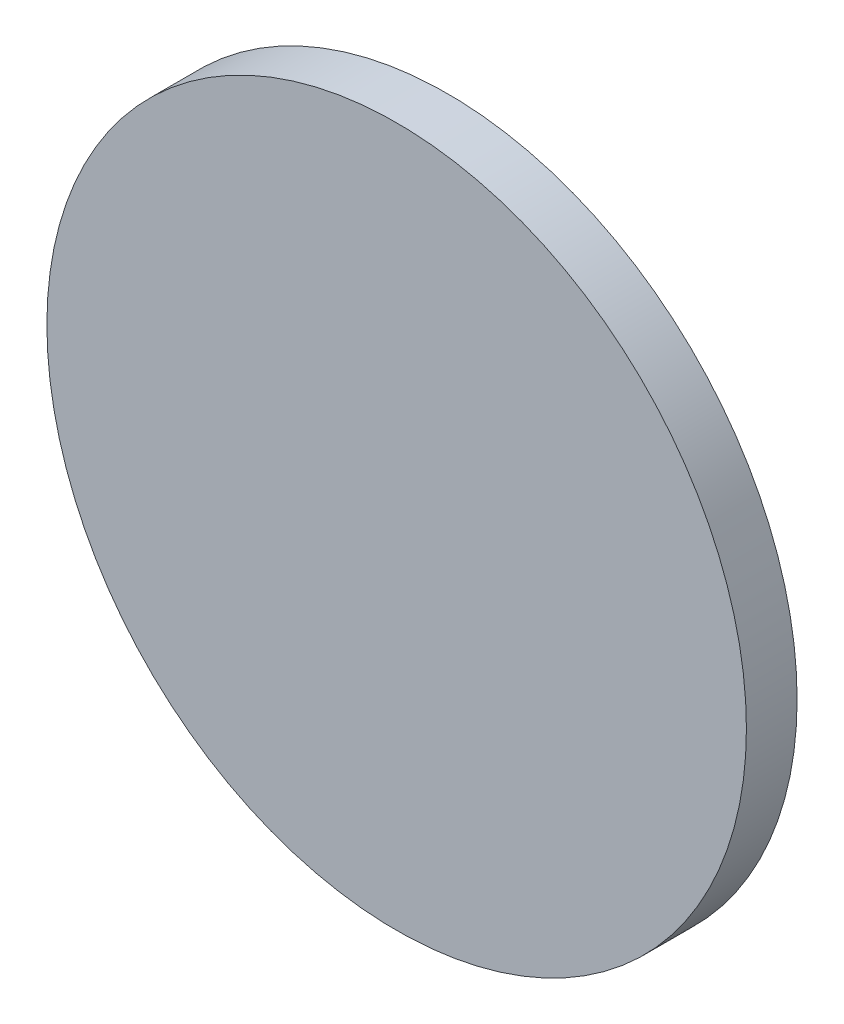
from build123d import *

# Parameters (mm, degrees)
SKETCH1_R           = 21.9075
BOSS_EXTRUDE1_DEPTH = 3.175


with BuildPart() as part:
    # Sketch1 → Boss-Extrude1 (new body)
    with BuildSketch(Plane.XY):
        Circle(SKETCH1_R)
    extrude(amount=BOSS_EXTRUDE1_DEPTH)


solid = part.part
